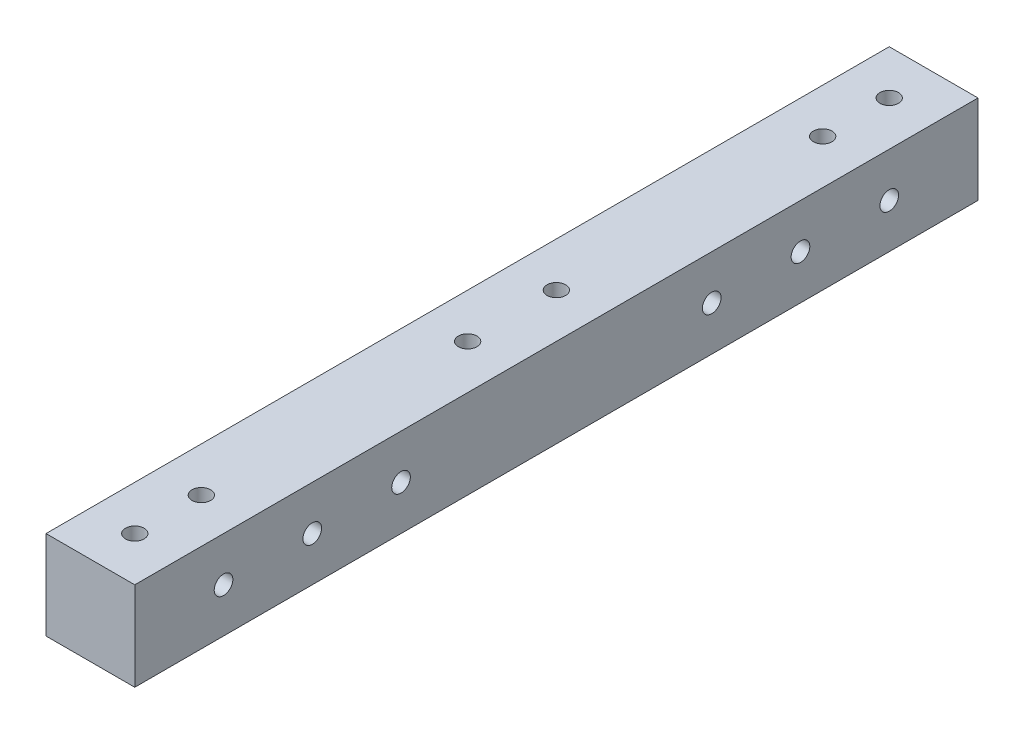
from build123d import *

# Parameters (mm, degrees)
SKETCH_1_W          = 20
SKETCH_1_H          = 20
EXTRUDE_1_DEPTH     = 190
SKETCH_2_R          = 2.1
CUT_EXTRUDE_1_DEPTH = 67
SKETCH_3_R          = 2.1
CUT_EXTRUDE_2_DEPTH = 32
SKETCH_4_R          = 2.1
CUT_EXTRUDE_3_DEPTH = 192.311264697


with BuildPart() as part:
    # 草图1 → 凸台-拉伸1 (new body)
    with BuildSketch(Plane.XY):
        Rectangle(SKETCH_1_W, SKETCH_1_H)
    extrude(amount=EXTRUDE_1_DEPTH)

    # 草图2 → 切除-拉伸1 (cut)
    with BuildSketch(Plane.ZY.offset(10)):
        with Locations(Location((40, 0, 0), (0, 0, 270))):
            Circle(SKETCH_2_R)
        with Locations(Location((20, 0, 0), (0, 0, 270))):
            Circle(SKETCH_2_R)
        with Locations(Location((60, 0, 0), (0, 0, 270))):
            Circle(SKETCH_2_R)
        with Locations(Location((130, 0, 0), (0, 0, 270))):
            Circle(SKETCH_2_R)
        with Locations(Location((170, 0, 0), (0, 0, 270))):
            Circle(SKETCH_2_R)
        with Locations(Location((150, 0, 0), (0, 0, 270))):
            Circle(SKETCH_2_R)
    extrude(amount=-CUT_EXTRUDE_1_DEPTH, mode=Mode.SUBTRACT)

    # 草图3 → 切除-拉伸2 (cut)
    with BuildSketch(Plane(origin=(0, 10, 0), x_dir=(1, 0, 0), z_dir=(0, 1, 0))):
        with Locations(Location((0, -180, 0), (0, 0, 270))):
            Circle(SKETCH_3_R)
        with Locations(Location((0, -165, 0), (0, 0, 270))):
            Circle(SKETCH_3_R)
        with Locations(Location((0, -25, 0), (0, 0, 270))):
            Circle(SKETCH_3_R)
        with Locations(Location((0, -10, 0), (0, 0, 270))):
            Circle(SKETCH_3_R)
    extrude(amount=-CUT_EXTRUDE_2_DEPTH, mode=Mode.SUBTRACT)

    # 草图4 → 切除-拉伸3 (cut, through all)
    with BuildSketch(Plane(origin=(0, 10, 0), x_dir=(1, 0, 0), z_dir=(0, 1, 0))):
        with Locations(Location((0, -85, 0), (0, 0, 270))):
            Circle(SKETCH_4_R)
        with Locations(Location((0, -105, 0), (0, 0, 90))):
            Circle(SKETCH_4_R)
    extrude(amount=-CUT_EXTRUDE_3_DEPTH, mode=Mode.SUBTRACT)


solid = part.part
